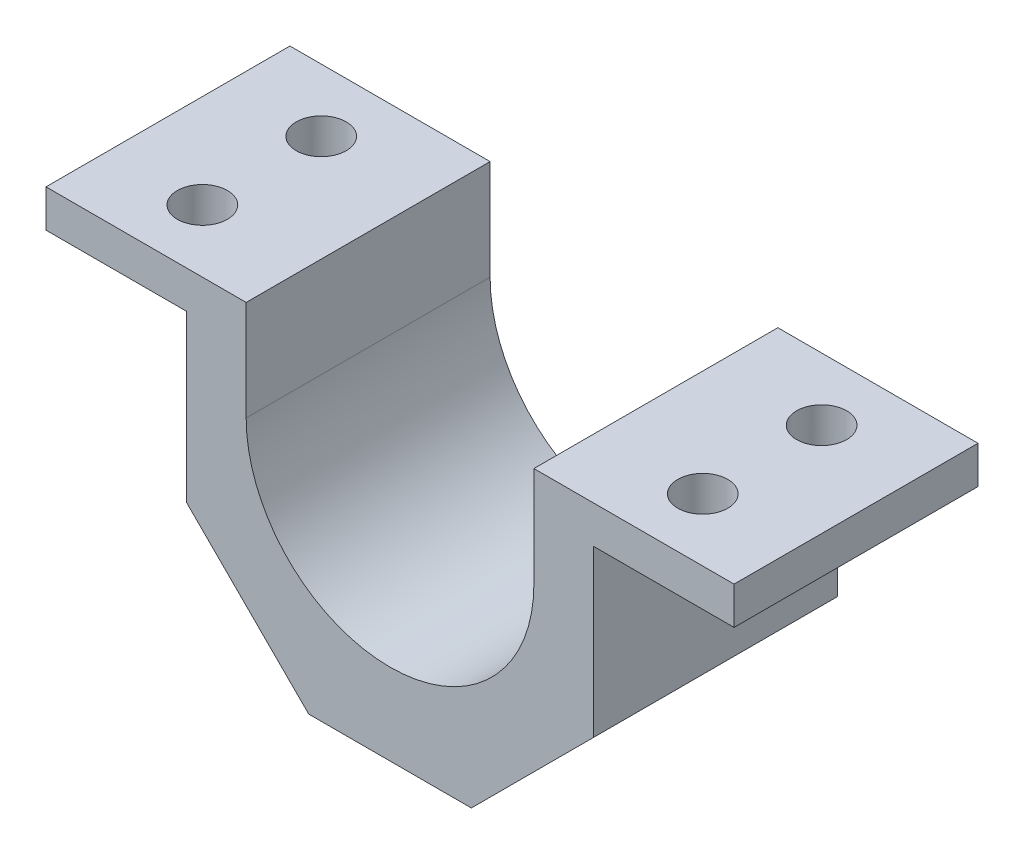
from build123d import *

# Parameters (mm, degrees)
BOSS_EXTRUDE1_DEPTH = 19.5
SKETCH2_R           = 4
CUT_EXTRUDE1_DEPTH  = 79.161691384


with BuildPart() as part:
    # Sketch1 → Boss-Extrude1 (new, symmetric)
    with BuildSketch(Plane.XY):
        with BuildLine():
            Line((55, 10), (32.5, 10))
            Line((32.5, 10), (32.5, -16.5))
            Line((32.5, -16.5), (13, -36))
            Line((13, -36), (-13, -36))
            Line((-13, -36), (-32.5, -16.5))
            Line((-32.5, -16.5), (-32.5, 10))
            Line((-32.5, 10), (-55, 10))
            Line((-55, 10), (-55, 16))
            Line((-55, 16), (-23, 16))
            Line((-23, 16), (-23, 0))
            ThreePointArc((-23, 0), (0, -23), (23, 0))
            Line((23, 0), (23, 16))
            Line((23, 16), (55, 16))
            Line((55, 16), (55, 10))
        make_face()
    extrude(amount=BOSS_EXTRUDE1_DEPTH, both=True)

    # Sketch2 → Cut-Extrude1 (cut, through all)
    with BuildSketch(Plane(origin=(0, 16, 0), x_dir=(1, 0, 0), z_dir=(0, 1, 0))):
        with Locations(Location((-40, -9.5, 0), (0, 0, 270))):
            Circle(SKETCH2_R)
        with Locations(Location((-40, 9.5, 0), (0, 0, 180))):
            Circle(SKETCH2_R)
        with Locations(Location((40, -9.5, 0), (0, 0, 180))):
            Circle(SKETCH2_R)
        with Locations(Location((40, 9.5, 0), (0, 0, 270))):
            Circle(SKETCH2_R)
    extrude(amount=-CUT_EXTRUDE1_DEPTH, mode=Mode.SUBTRACT)


solid = part.part
